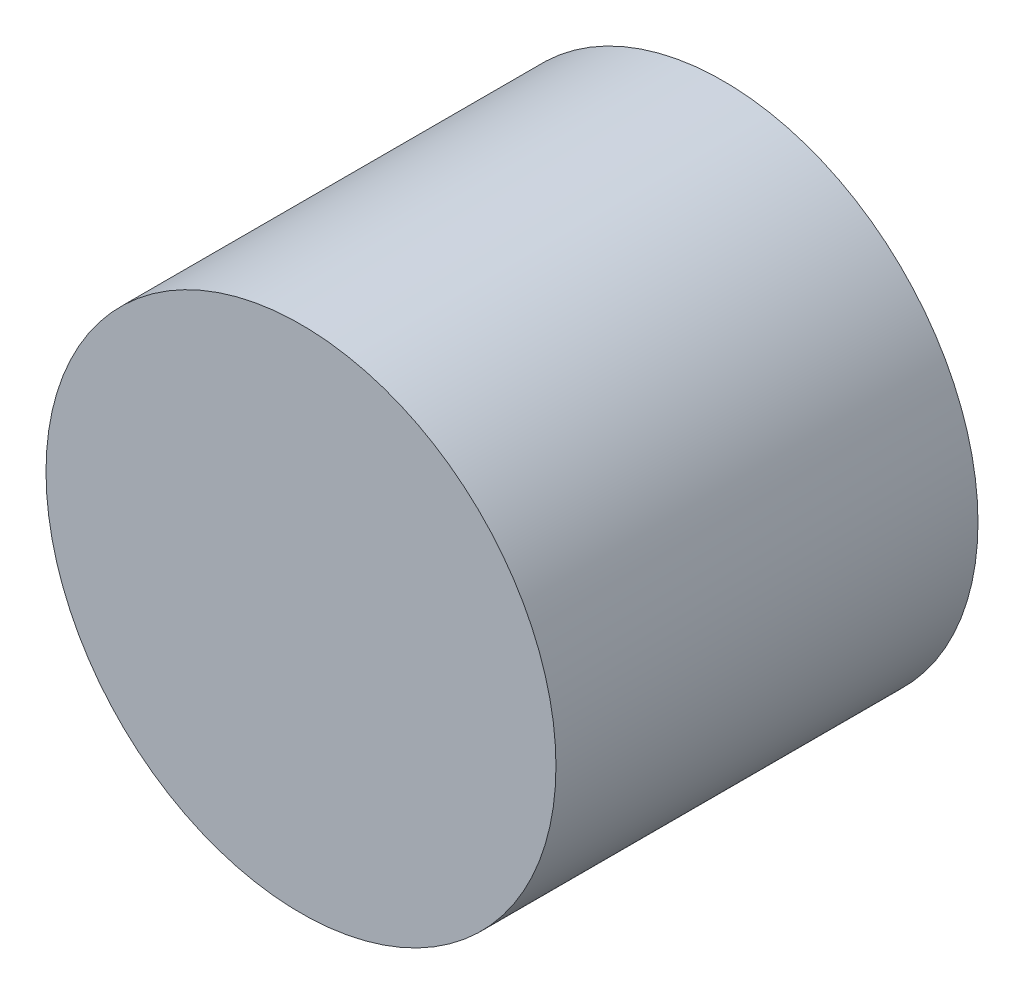
from build123d import *

# Parameters (mm, degrees)
SCHIZZO1_R                   = 14.5
ESTRUSIONE_ESTRUSIONE1_DEPTH = 24
SCHIZZO2_R                   = 5.1
ESTRUSIONE_ESTRUSIONE2_DEPTH = 2


with BuildPart() as part:
    # Schizzo1 → Estrusione-Estrusione1 (new body)
    with BuildSketch(Plane.XY):
        with Locations((4.189233611, -21.321452148)):
            Circle(SCHIZZO1_R)
    extrude(amount=ESTRUSIONE_ESTRUSIONE1_DEPTH)

    # Schizzo2 → Estrusione-Estrusione2 (add)
    with BuildSketch(Plane(origin=(0, 0, 0), x_dir=(-1, 0, 0), z_dir=(0, 0, -1))):
        with Locations((-4.189233611, -21.321452148)):
            Circle(SCHIZZO2_R)
    extrude(amount=ESTRUSIONE_ESTRUSIONE2_DEPTH)


solid = part.part
